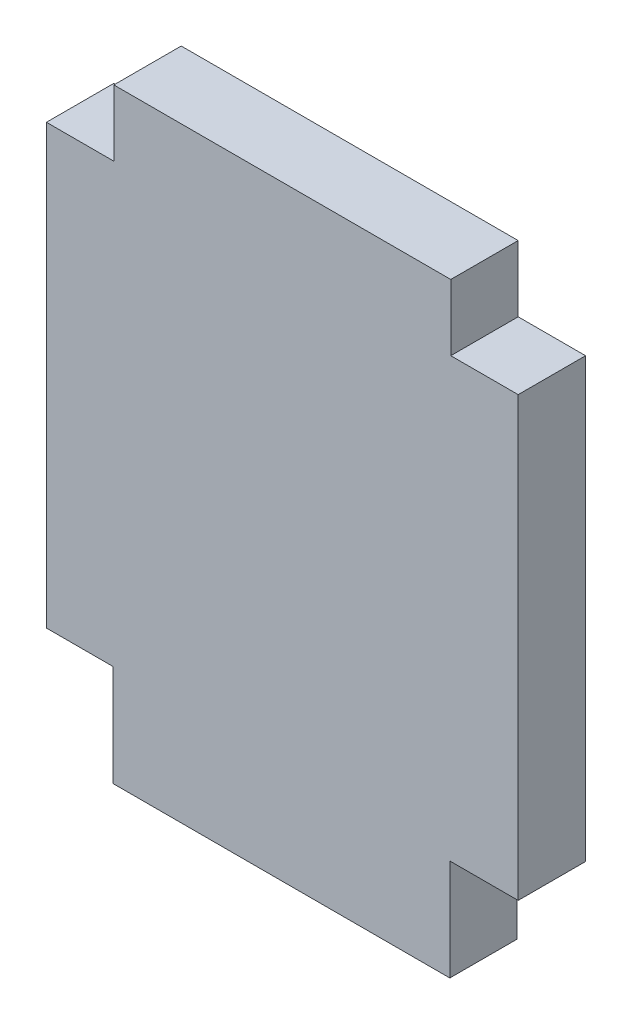
from build123d import *

# Parameters (mm, degrees)
BOSS_EXTRUDE1_DEPTH = 5.08


with BuildPart() as part:
    # Sketch1 → Boss-Extrude1 (new body)
    with BuildSketch(Plane.XY):
        Polygon((48.719642696, 135.965208253), (43.639642696, 135.965208253), (43.639642696, 140.943259367), (18.239642696, 140.943259367), (18.239642696, 135.965208253), (13.159642696, 135.965208253), (13.159642696, 122.527539749), (13.159642696, 102.945208253), (18.167168791, 102.945208253), (18.167168791, 95.305446869), (43.567168791, 95.305446869), (43.567168791, 102.945208253), (48.719642696, 102.945208253), (48.719642696, 122.527539749), align=None)
    extrude(amount=BOSS_EXTRUDE1_DEPTH)


solid = part.part
